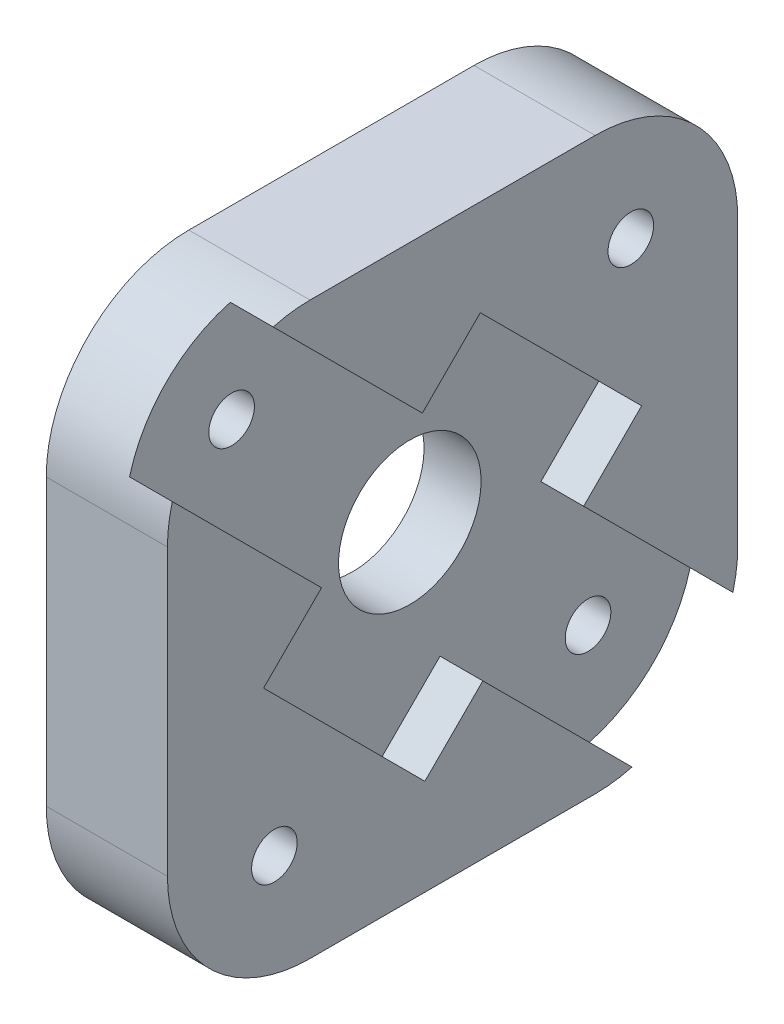
from build123d import *

# Parameters (mm, degrees)
SKETCH1_W           = 40
SKETCH1_H           = 40
BOSS_EXTRUDE1_DEPTH = 8.5
FILLET1_R           = 10
CUT_EXTRUDE1_DEPTH  = 3
SKETCH4_R           = 5
CUT_EXTRUDE2_DEPTH  = 29.814059068
SKETCH5_R           = 1.6
CUT_EXTRUDE3_DEPTH  = 30.533878851
CUT_EXTRUDE4_DEPTH  = 3
SKETCH8_R           = 12.5
CUT_EXTRUDE5_DEPTH  = 1.5


with BuildPart() as part:
    # Sketch1 → Boss-Extrude1 (new body)
    with BuildSketch(Plane(origin=(0, 0, 0), x_dir=(0, 0, -1), z_dir=(1, 0, 0))):
        Rectangle(SKETCH1_W, SKETCH1_H)
    extrude(amount=BOSS_EXTRUDE1_DEPTH)

    # Fillet1
    fillet1_edges = [part.edges().sort_by_distance(p)[0] for p in [
        (4.25, -20, -20),
        (4.25, -20, 20),
        (4.25, 20, 20),
        (4.25, 20, -20),
    ]]
    fillet(fillet1_edges, radius=FILLET1_R)

    # Sketch2 → Cut-Extrude1 (cut)
    with BuildSketch(Plane(origin=(8.5, 0, 0), x_dir=(0, 0, -1), z_dir=(1, 0, 0))):
        Polygon((-1.944543648, -13.258252147), (13.258252147, 1.944543648), (1.944543648, 13.258252147), (-13.258252147, -1.944543648), align=None)
    extrude(amount=-CUT_EXTRUDE1_DEPTH, mode=Mode.SUBTRACT)

    # Sketch4 → Cut-Extrude2 (cut, through all)
    with BuildSketch(Plane(origin=(5.5, 0, 0), x_dir=(0, 0, -1), z_dir=(1, 0, 0))):
        Circle(SKETCH4_R)
    extrude(amount=-CUT_EXTRUDE2_DEPTH, mode=Mode.SUBTRACT)

    # Sketch5 → Cut-Extrude3 (cut, through all)
    with BuildSketch(Plane(origin=(8.5, 0, 0), x_dir=(0, 0, -1), z_dir=(1, 0, 0))):
        with Locations((-12.5, 12.5)):
            Circle(SKETCH5_R)
        with Locations((-12.5, -12.5)):
            Circle(SKETCH5_R)
        with Locations((12.5, -12.5)):
            Circle(SKETCH5_R)
        with Locations((12.5, 12.5)):
            Circle(SKETCH5_R)
    extrude(amount=-CUT_EXTRUDE3_DEPTH, mode=Mode.SUBTRACT)

    # Sketch7 → Cut-Extrude4 (cut)
    with BuildSketch(Plane(origin=(8.5, 0, 0), x_dir=(0, 0, -1), z_dir=(1, 0, 0))):
        Polygon((14.142135624, -21.213203436), (-21.213203436, 14.142135624), (-14.142135624, 21.213203436), (21.213203436, -14.142135624), align=None)
    extrude(amount=-CUT_EXTRUDE4_DEPTH, mode=Mode.SUBTRACT)

    # Sketch8 → Cut-Extrude5 (cut)
    with BuildSketch(Plane.ZY):
        Circle(SKETCH8_R)
    extrude(amount=-CUT_EXTRUDE5_DEPTH, mode=Mode.SUBTRACT)


solid = part.part
